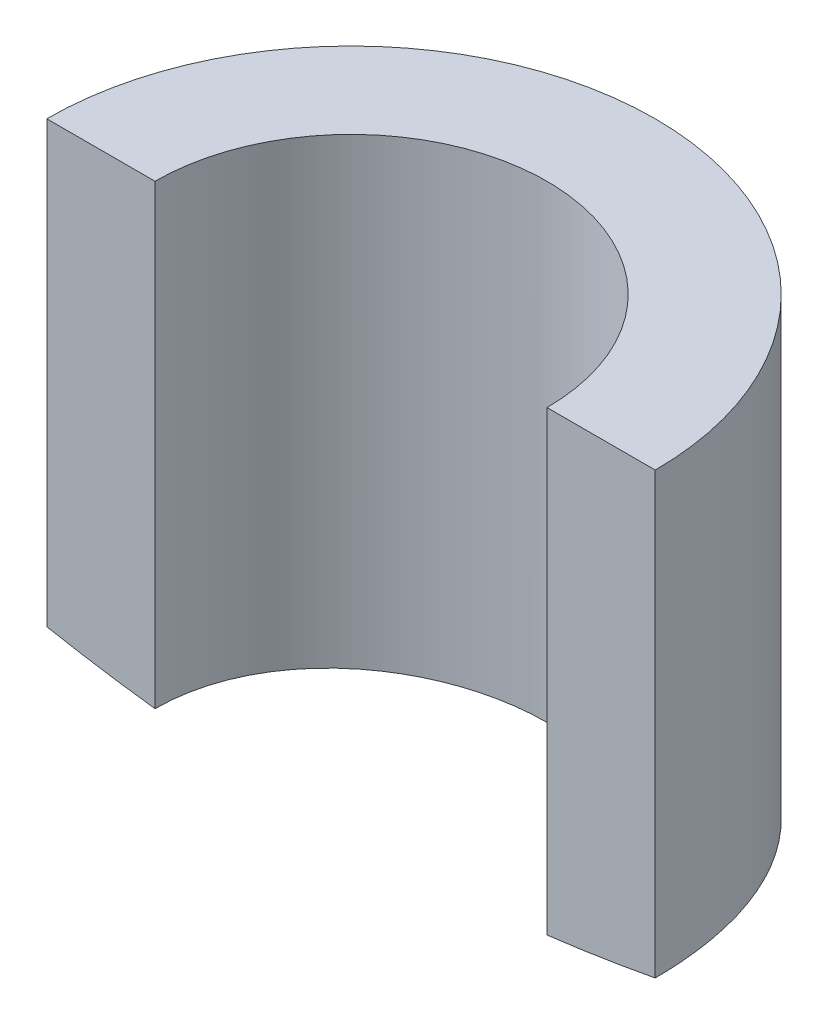
from build123d import *

# Parameters (mm, degrees)
BOSS_EXTRUDE1_DEPTH = 11
CUT_EXTRUDE1_REACH  = 16.932


with BuildPart() as part:
    # Sketch1 → Boss-Extrude1 (new body)
    with BuildSketch(Plane(origin=(0, 0, 0), x_dir=(1, 0, 0), z_dir=(0, 1, 0))):
        with BuildLine():
            Line((4.6, 0), (7.14, 0))
            ThreePointArc((7.14, 0), (0, 7.14), (-7.14, 0))
            Line((-7.14, 0), (-4.6, 0))
            ThreePointArc((-4.6, 0), (0, 4.6), (4.6, 0))
        make_face()
    extrude(amount=BOSS_EXTRUDE1_DEPTH)

    # Sketch4 → Cut-Extrude1 (cut, up to next)
    with BuildSketch(Plane.XY, mode=Mode.PRIVATE) as cut_extrude1_sk1:
        with BuildLine():
            Line((-7.14, 0.675003006), (-7.14, 0))
            Line((-7.14, 0), (-7.14, -1.06362805))
            Line((-7.14, -1.06362805), (7.14, -1.06362805))
            Line((7.14, -1.06362805), (7.14, 0))
            Line((7.14, 0), (7.14, 0.675003006))
            ThreePointArc((7.14, 0.675003006), (0, 0), (-7.14, 0.675003006))
        make_face()
    cut_extrude1_tool1 = extrude(cut_extrude1_sk1.sketch, amount=-CUT_EXTRUDE1_REACH, mode=Mode.PRIVATE) & part.part
    add(cut_extrude1_tool1.solids().sort_by_distance((0, -0.404031, 0))[0], mode=Mode.SUBTRACT)
    add(cut_extrude1_tool1.solids().sort_by_distance((0, -0.404031, 0))[1], mode=Mode.SUBTRACT)


solid = part.part
